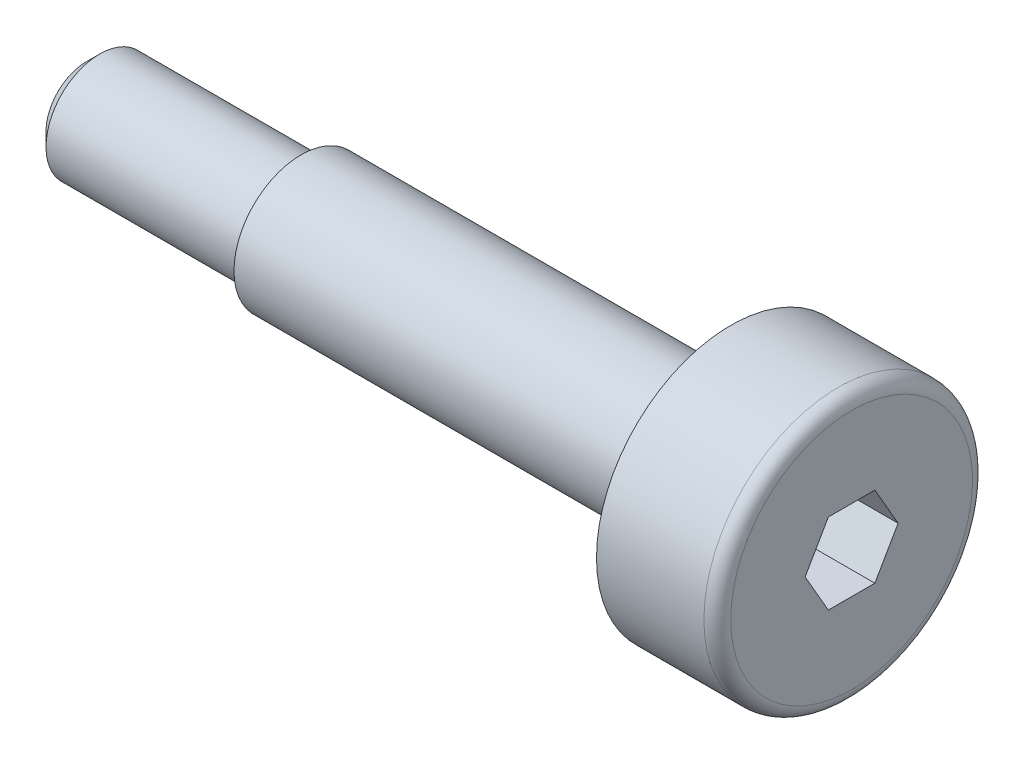
from build123d import *

# Parameters (mm, degrees)
CHAMFER1_SIZE      = 0.5
CUT_EXTRUDE1_DEPTH = 2.4


with BuildPart() as part:
    # Sketch1 → Revolve1 (revolve)
    with BuildSketch(Plane.XY):
        with BuildLine():
            Line((0, 0), (0, 4.5))
            ThreePointArc((0, 4.5), (-0.146446609, 4.853553391), (-0.5, 5))
            Line((-0.5, 5), (-4.5, 5))
            Line((-4.5, 5), (-4.5, 2.5))
            Line((-4.5, 2.5), (-20.5, 2.5))
            Line((-20.5, 2.5), (-20.5, 2))
            Line((-20.5, 2), (-28.5, 2))
            Line((-28.5, 2), (-28.5, 0))
            Line((-28.5, 0), (0, 0))
        make_face()
    revolve(axis=Axis((0, 0, 0), (1, 0, 0)))

    # Chamfer1
    chamfer1_edges = [part.edges().sort_by_distance(p)[0] for p in [
        (-28.5, -2, 0),
    ]]
    chamfer(chamfer1_edges, length=CHAMFER1_SIZE)

    # Sketch2 → Cut-Extrude1 (cut)
    with BuildSketch(Plane(origin=(0, 0, 0), x_dir=(0, 0, -1), z_dir=(1, 0, 0))):
        Polygon((1.732050808, 0), (0.866025404, 1.5), (-0.866025404, 1.5), (-1.732050808, 0), (-0.866025404, -1.5), (0.866025404, -1.5), align=None)
    extrude(amount=-CUT_EXTRUDE1_DEPTH, mode=Mode.SUBTRACT)


solid = part.part
